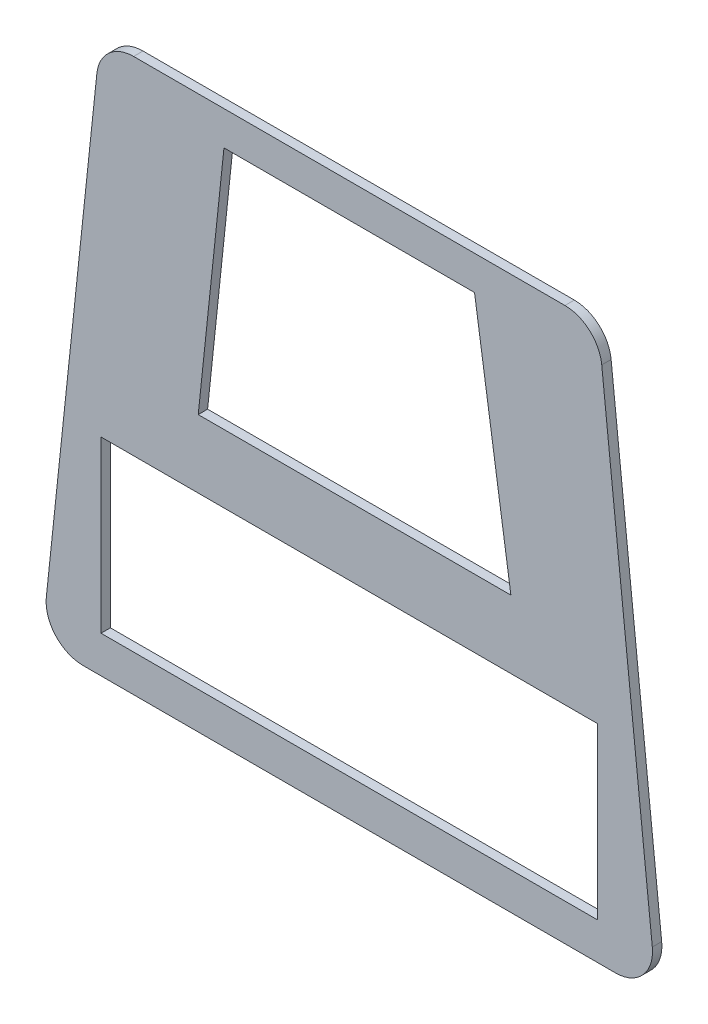
from build123d import *

# Parameters (mm, degrees)
SKETCH1_W           = 336
SKETCH1_H           = 115
BOSS_EXTRUDE1_DEPTH = 6.35
CUT_EXTRUDE1_DEPTH  = 6.35


with BuildPart() as part:
    # Sketch1 → Boss-Extrude1 (new body)
    with BuildSketch(Plane.XY):
        with BuildLine():
            Line((145.931677019, 105.5), (-145.931677019, 105.5))
            ThreePointArc((-145.931677019, 105.5), (-162.655478234, 99.082639019), (-170.793465899, 83.125157832))
            Line((-170.793465899, 83.125157832), (-205.004646024, -240.874842168))
            ThreePointArc((-205.004646024, -240.874842168), (-198.725496162, -260.223801216), (-180.142857143, -268.5))
            Line((-180.142857143, -268.5), (180.142857143, -268.5))
            ThreePointArc((180.142857143, -268.5), (198.725496162, -260.223801216), (205.004646024, -240.874842168))
            Line((205.004646024, -240.874842168), (170.793465899, 83.125157832))
            ThreePointArc((170.793465899, 83.125157832), (162.655478234, 99.082639019), (145.931677019, 105.5))
        make_face()
        Polygon((-83, 80.5), (83, 80.5), (107, -80.5), (-100, -80.5), align=None, mode=Mode.SUBTRACT)
        with Locations((0, -186)):
            Rectangle(SKETCH1_W, SKETCH1_H, mode=Mode.SUBTRACT)
    extrude(amount=BOSS_EXTRUDE1_DEPTH)

    # Sketch2 → Cut-Extrude1 (cut)
    with BuildSketch(Plane.XY.offset(6.35)):
        Polygon((-102.222298481, -82.5), (109.320235916, -82.5), (84.723962625, 82.5), (-84.799938233, 82.5), align=None)
    extrude(amount=-CUT_EXTRUDE1_DEPTH, mode=Mode.SUBTRACT)


solid = part.part
